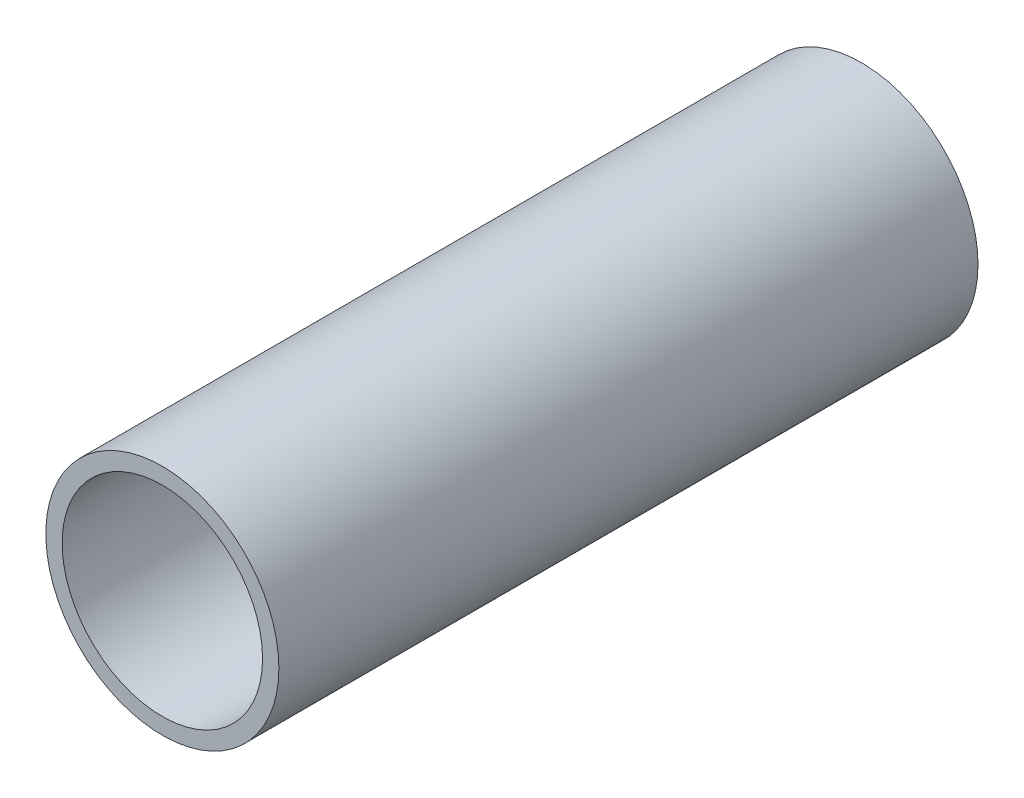
from build123d import *

# Parameters (mm, degrees)
SKETCH1_R          = 6.35
SKETCH1_R_2        = 5.461
EXTRUDE1_DEPTH     = 38.1
SKETCH2_R          = 2
CUT_EXTRUDE1_DEPTH = 10


with BuildPart() as part:
    # Sketch1 → Extrude1 (new body)
    with BuildSketch(Plane.XY):
        with Locations(Location((0, 0, 0), (0, 0, 180))):
            Circle(SKETCH1_R)
        with Locations(Location((0, 0, 0), (0, 0, 180))):
            Circle(SKETCH1_R_2, mode=Mode.SUBTRACT)
    extrude(amount=EXTRUDE1_DEPTH)

    # Sketch2 → Cut-Extrude1 (cut)
    with BuildSketch(Plane(origin=(0, 0, 0), x_dir=(1, 0, 0), z_dir=(0, 1, 0))):
        with Locations(Location((0, -9.525, 0), (0, 0, 270))):
            Circle(SKETCH2_R)
        with Locations(Location((0, -28.575, 0), (0, 0, 270))):
            Circle(SKETCH2_R)
    extrude(amount=-CUT_EXTRUDE1_DEPTH, mode=Mode.SUBTRACT)


solid = part.part
